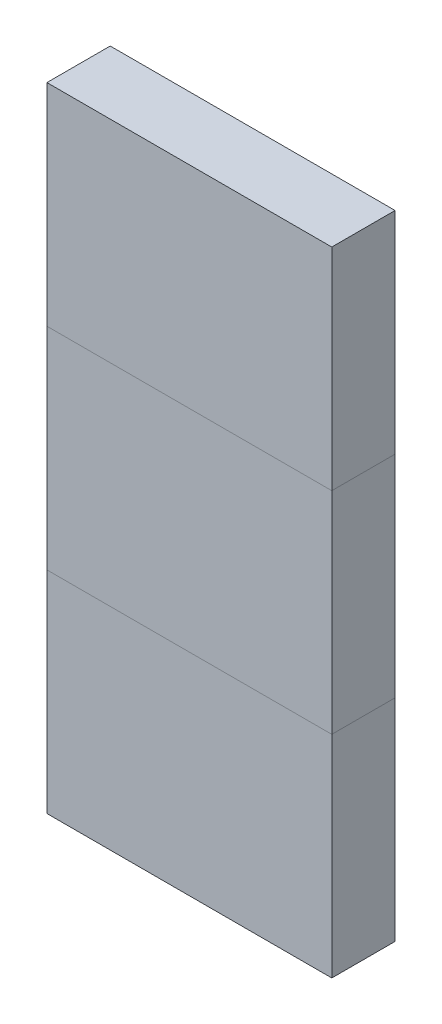
from build123d import *

# Parameters (mm, degrees)
SKETCH1_W                = 57.15
SKETCH1_H                = 127
BOSS_EXTRUDE1_DEPTH      = 6.35
SKETCH2_W                = 6.400000027
SKETCH2_H                = 3.175
SKETCH2_W_2              = 37.999999946
CUT_EXTRUDE1_DEPTH       = 57.15
SPLIT1_SURFACE_1_1_BACK  = 140.844
SPLIT1_SURFACE_1_1_DEPTH = 281.688
SPLIT1_SURFACE_1_2_BACK  = 140.844
SPLIT1_SURFACE_1_2_DEPTH = 281.688
SPLIT1_SURFACE_2_3_BACK  = 140.844
SPLIT1_SURFACE_2_3_DEPTH = 281.688
SPLIT1_SURFACE_2_4_BACK  = 140.844
SPLIT1_SURFACE_2_4_DEPTH = 281.688
SKETCH4_W                = 37.999999946
SKETCH4_H                = 3.175
BOSS_EXTRUDE2_DEPTH      = 6.600000008


with BuildPart() as part:
    # Sketch1 → Boss-Extrude1 (new, symmetric)
    with BuildSketch(Plane.XY):
        Rectangle(SKETCH1_W, SKETCH1_H)
    extrude(amount=BOSS_EXTRUDE1_DEPTH, both=True)

    # Sketch2 → Cut-Extrude1 (cut, symmetric)
    with BuildSketch(Plane(origin=(0, 0, 0), x_dir=(1, 0, 0), z_dir=(0, 1, 0))):
        with Locations((-22.199999987, 0)):
            Rectangle(SKETCH2_W, SKETCH2_H)
        Rectangle(SKETCH2_W_2, SKETCH2_H)
        with Locations((0, 3.175)):
            Rectangle(SKETCH2_W_2, SKETCH2_H)
        with Locations((0, -3.175)):
            Rectangle(SKETCH2_W_2, SKETCH2_H)
        with Locations((22.199999987, 0)):
            Rectangle(SKETCH2_W, SKETCH2_H)
    extrude(amount=CUT_EXTRUDE1_DEPTH, both=True, mode=Mode.SUBTRACT)


with BuildPart() as body_2:
    # Split1: the piece behind the surface
    add(part.part)
    # Split1 surface 1: a surface, the sketch's curves swept straight by 281.688 mm
    with BuildLine(Plane.XY.offset(6.35).offset(-SPLIT1_SURFACE_1_1_BACK), mode=Mode.PRIVATE) as split1_surface_1_1_path:
        Line((-28.575, 21.166666667), (28.575, 21.166666667))
    split1_surface_1_1 = Shell.extrude(split1_surface_1_1_path.wire(), (0 * SPLIT1_SURFACE_1_1_DEPTH, 0 * SPLIT1_SURFACE_1_1_DEPTH, 1 * SPLIT1_SURFACE_1_1_DEPTH))
    split(bisect_by=split1_surface_1_1, keep=Keep.BOTTOM)


with BuildPart() as part_1:
    add(part.part)

    # Split1: split by a surface, the side it looks to stays
    # Split1 surface 1: a surface, the sketch's curves swept straight by 281.688 mm
    with BuildLine(Plane.XY.offset(6.35).offset(-SPLIT1_SURFACE_1_2_BACK), mode=Mode.PRIVATE) as split1_surface_1_2_path:
        Line((-28.575, 21.166666667), (28.575, 21.166666667))
    split1_surface_1_2 = Shell.extrude(split1_surface_1_2_path.wire(), (0 * SPLIT1_SURFACE_1_2_DEPTH, 0 * SPLIT1_SURFACE_1_2_DEPTH, 1 * SPLIT1_SURFACE_1_2_DEPTH))
    split(bisect_by=split1_surface_1_2, keep=Keep.TOP)

    # Sketch4 → Boss-Extrude2 (add)
    with BuildSketch(Plane.XZ.offset(-57.15)):
        with Locations((0, 3.175)):
            Rectangle(SKETCH4_W, SKETCH4_H)
        with Locations((0, -3.175)):
            Rectangle(SKETCH4_W, SKETCH4_H)
    extrude(amount=BOSS_EXTRUDE2_DEPTH)


with BuildPart() as body_3:
    # Split1 2 body 2: the piece behind the surface
    add(body_2.part)
    # Split1 surface 2: a surface, the sketch's curves swept straight by 281.688 mm
    with BuildLine(Plane.XY.offset(6.35).offset(-SPLIT1_SURFACE_2_3_BACK), mode=Mode.PRIVATE) as split1_surface_2_3_path:
        Line((28.575, -21.166666667), (-28.575, -21.166666667))
    split1_surface_2_3 = Shell.extrude(split1_surface_2_3_path.wire(), (0 * SPLIT1_SURFACE_2_3_DEPTH, 0 * SPLIT1_SURFACE_2_3_DEPTH, 1 * SPLIT1_SURFACE_2_3_DEPTH))
    split(bisect_by=split1_surface_2_3, keep=Keep.BOTTOM)


with BuildPart() as body_2_1:
    add(body_2.part)

    # Split1 2 body 2: split by a surface, the side it looks to stays
    # Split1 surface 2: a surface, the sketch's curves swept straight by 281.688 mm
    with BuildLine(Plane.XY.offset(6.35).offset(-SPLIT1_SURFACE_2_4_BACK), mode=Mode.PRIVATE) as split1_surface_2_4_path:
        Line((28.575, -21.166666667), (-28.575, -21.166666667))
    split1_surface_2_4 = Shell.extrude(split1_surface_2_4_path.wire(), (0 * SPLIT1_SURFACE_2_4_DEPTH, 0 * SPLIT1_SURFACE_2_4_DEPTH, 1 * SPLIT1_SURFACE_2_4_DEPTH))
    split(bisect_by=split1_surface_2_4, keep=Keep.TOP)


solid = Compound([part_1.part, body_3.part, body_2_1.part])
